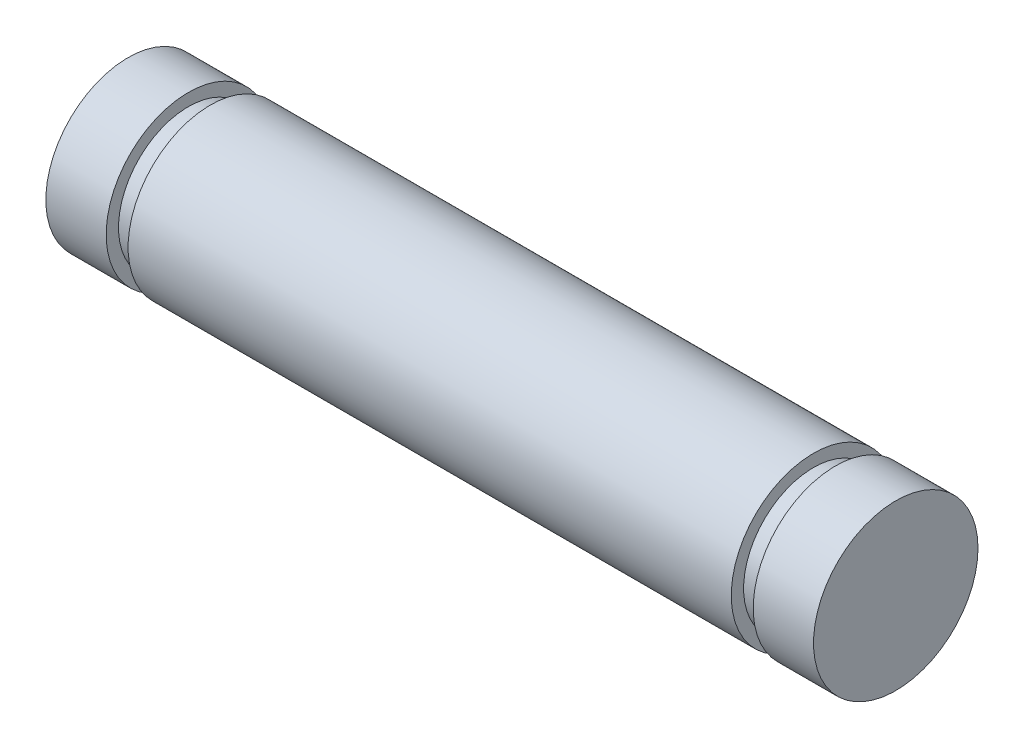
from build123d import *


with BuildPart() as part:
    # Croquis1 → Revolución1 (revolve)
    with BuildSketch(Plane(origin=(0, 0, 0), x_dir=(-1, 0, 0), z_dir=(0, 1, 0)), mode=Mode.PRIVATE) as revoluci_n1_sk:
        Polygon((-11, 3), (11, 3), (11, 2.55), (11.8, 2.55), (11.8, 3), (14, 3), (14, 0), (-14, 0), (-14, 3), (-11.8, 3), (-11.8, 2.55), (-11, 2.55), align=None)
    revolve(revoluci_n1_sk.sketch.rotate(Axis((14, 0, 0), (-1, 0, 0)), 180), axis=Axis((14, 0, 0), (-1, 0, 0)))


solid = part.part
